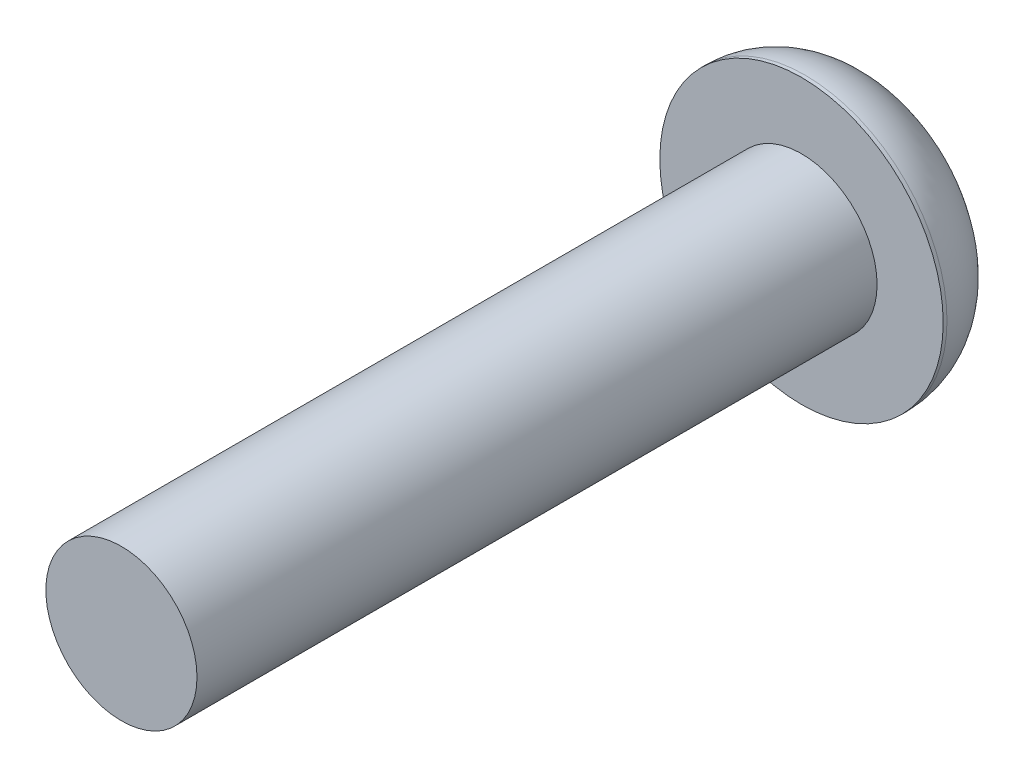
from build123d import *

# Parameters (mm, degrees)
SKETCH_1_R      = 2
EXTRUDE_1_DEPTH = 18
SKETCH_2_R      = 3.75
EXTRUDE_2_DEPTH = 2.1
FILLET_1_R      = 2


with BuildPart() as part:
    # 草图1 → 凸台-拉伸1 (new body)
    with BuildSketch(Plane.XY):
        Circle(SKETCH_1_R)
    extrude(amount=EXTRUDE_1_DEPTH)

    # 草图2 → 凸台-拉伸2 (add)
    with BuildSketch(Plane(origin=(0, 0, 0), x_dir=(-1, 0, 0), z_dir=(0, 0, -1))):
        Circle(SKETCH_2_R)
    extrude(amount=EXTRUDE_2_DEPTH)

    # 圆角1
    fillet_1_edges = [part.edges().sort_by_distance(p)[0] for p in [
        (3.75, 0, -2.1),
    ]]
    fillet(fillet_1_edges, radius=FILLET_1_R)


solid = part.part
